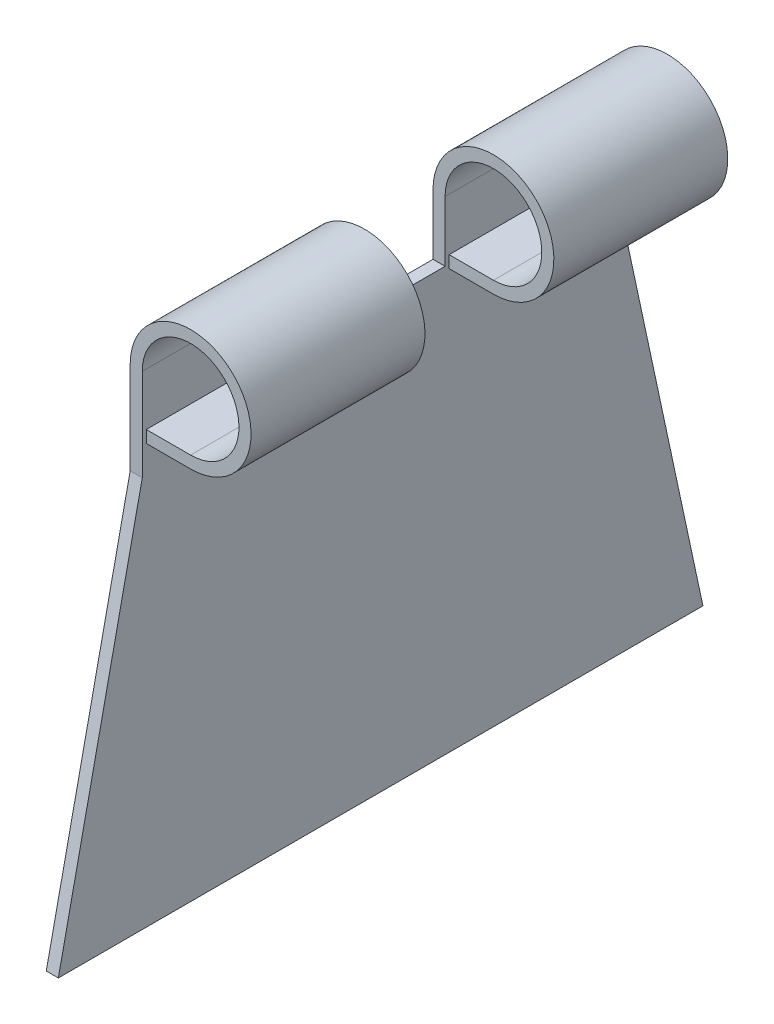
from build123d import *

# Parameters (mm, degrees)
EXTRUDE_1_DEPTH     = 80
CUT_EXTRUDE_1_DEPTH = 7.5
CUT_EXTRUDE_3_DEPTH = 102.118742081


with BuildPart() as part:
    # 草图1 → 凸台-拉伸1 (new body)
    with BuildSketch(Plane.XY):
        with BuildLine():
            Line((-7.5, -60), (-6, -60))
            Line((-6, -60), (-6, 0))
            ThreePointArc((-6, 0), (4.242640687, 4.242640687), (0, -6))
            Line((0, -6), (-5.5, -6))
            Line((-5.5, -6), (-5.5, -7.5))
            Line((-5.5, -7.5), (0, -7.5))
            ThreePointArc((0, -7.5), (5.303300859, 5.303300859), (-7.5, 0))
            Line((-7.5, 0), (-7.5, -60))
        make_face()
    extrude(amount=EXTRUDE_1_DEPTH)

    # 草图3 → 切除-拉伸1 (cut, symmetric)
    with BuildSketch(Plane(origin=(0, 0, 0), x_dir=(1, 0, 0), z_dir=(0, 1, 0))):
        Polygon((7.5, -40), (7.5, -32), (-7.5, -32), (-7.5, -48), (7.5, -48), align=None)
    extrude(amount=CUT_EXTRUDE_1_DEPTH, both=True, mode=Mode.SUBTRACT)

    # 草图5 → 切除-拉伸3 (cut, through all)
    with BuildSketch(Plane.ZY.offset(7.5)):
        Polygon((80, -60), (69.585166332, -11.440975615), (69.585166332, 7.476358761), (69.585166332, 9.692514451), (80, 9.692514451), (80, 7.5), align=None)
        Polygon((10.414833668, -11.440975615), (10.414833668, 7.476358761), (10.414833668, 9.692514451), (0, 9.692514451), (0, 7.5), (0, -60), align=None)
    extrude(amount=-CUT_EXTRUDE_3_DEPTH, mode=Mode.SUBTRACT)


solid = part.part
